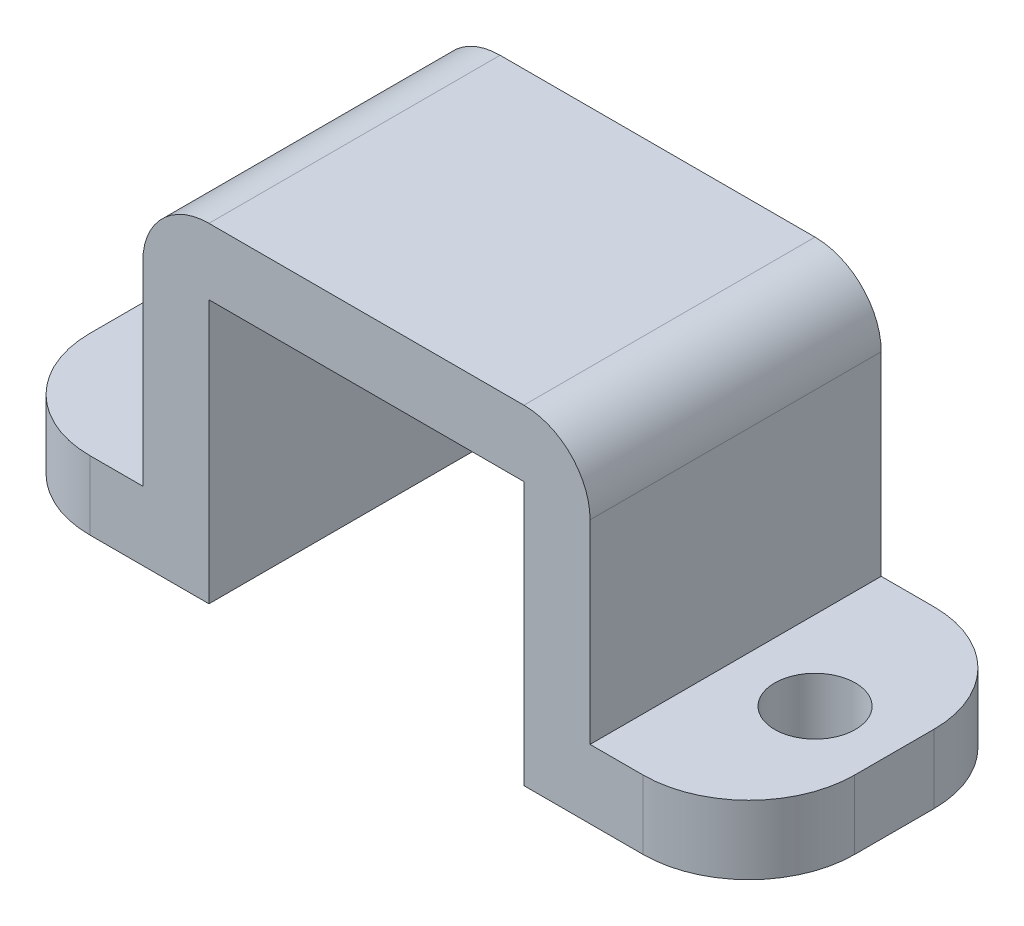
from build123d import *

# Parameters (mm, degrees)
BOSS_EXTRUDE1_DEPTH = 11
FILLET1_R           = 4
FILLET2_R           = 2.5
SKETCH2_R           = 1.525
CUT_EXTRUDE1_DEPTH  = 11


with BuildPart() as part:
    # Sketch1 → Boss-Extrude1 (new body)
    with BuildSketch(Plane.XY):
        Polygon((-5.95, 0), (-5.95, 9.95), (5.95, 9.95), (5.95, 0), (8.65875, 0), (14.45, 0), (14.45, 2.6), (8.45, 2.6), (8.45, 12.45), (-8.45, 12.45), (-8.45, 2.6), (-14.45, 2.6), (-14.45, 0), (-8.65875, 0), align=None)
    extrude(amount=BOSS_EXTRUDE1_DEPTH)

    # Fillet1
    fillet1_edges = [part.edges().sort_by_distance(p)[0] for p in [
        (-14.45, 1.3, 0),
        (14.45, 1.3, 0),
        (14.45, 1.3, 11),
        (-14.45, 1.3, 11),
    ]]
    fillet(fillet1_edges, radius=FILLET1_R)

    # Fillet2
    fillet2_edges = [part.edges().sort_by_distance(p)[0] for p in [
        (-8.45, 12.45, 5.5),
        (8.45, 12.45, 5.5),
    ]]
    fillet(fillet2_edges, radius=FILLET2_R)

    # Sketch2 → Cut-Extrude1 (cut)
    with BuildSketch(Plane(origin=(0, 2.6, 0), x_dir=(1, 0, 0), z_dir=(0, 1, 0))):
        with Locations(Location((-11.45, -5.5, 0), (0, 0, 180))):
            Circle(SKETCH2_R)
        with Locations(Location((11.45, -5.5, 0), (0, 0, 180))):
            Circle(SKETCH2_R)
    extrude(amount=-CUT_EXTRUDE1_DEPTH, mode=Mode.SUBTRACT)


solid = part.part
